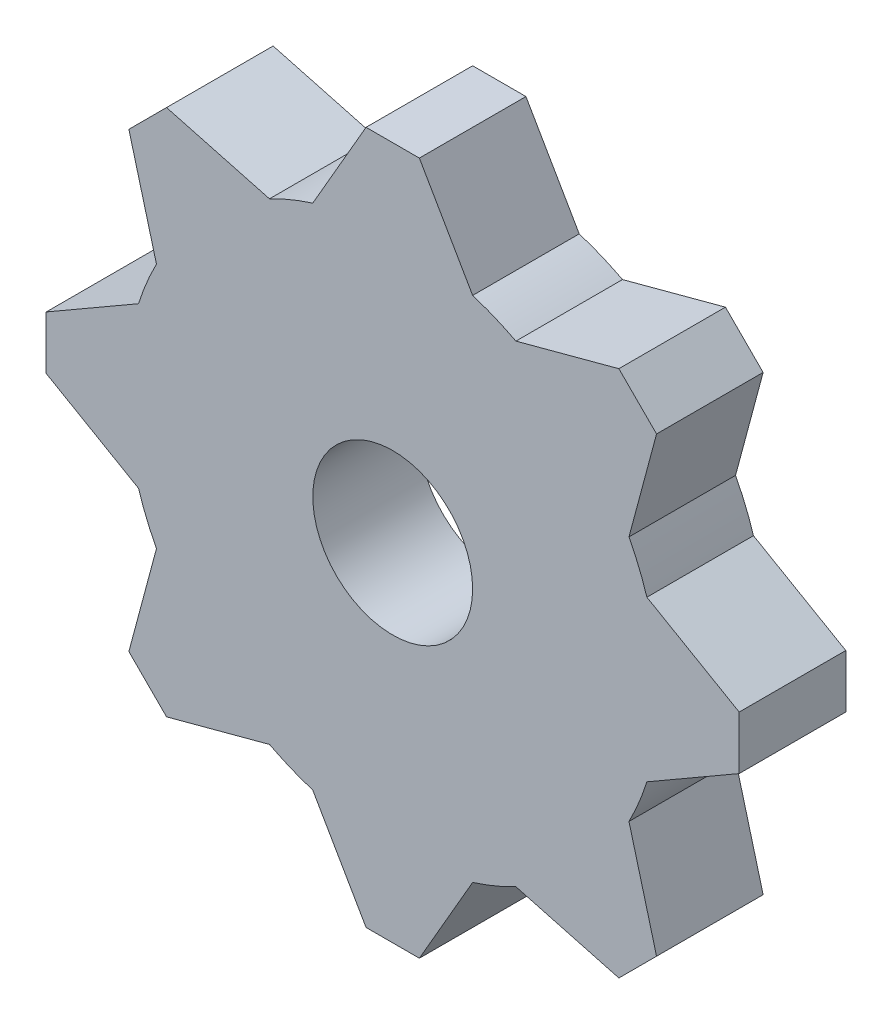
from build123d import *

# Parameters (mm, degrees)
SZKIC1_R                    = 15
DODANIE_WYCI_GNI_CIE1_DEPTH = 20


with BuildPart() as part:
    # Szkic1 → Dodanie-wyciągnięcie1 (new body)
    with BuildSketch(Plane.XY):
        with BuildLine():
            Line((-5, 65.017468147), (5, 65.017468147))
            Line((5, 65.017468147), (15, 47.696960071))
            ThreePointArc((15, 47.696960071), (19.134171618, 46.193976626), (23.12024219, 44.333445626))
            Line((23.12024219, 44.333445626), (42.438758716, 49.509826528))
            Line((42.438758716, 49.509826528), (49.509826528, 42.438758716))
            Line((49.509826528, 42.438758716), (44.333445626, 23.12024219))
            ThreePointArc((44.333445626, 23.12024219), (46.193976626, 19.134171618), (47.696960071, 15))
            Line((47.696960071, 15), (65.017468147, 5))
            Line((65.017468147, 5), (65.017468147, -5))
            Line((65.017468147, -5), (47.696960071, -15))
            ThreePointArc((47.696960071, -15), (46.193976626, -19.134171618), (44.333445626, -23.12024219))
            Line((44.333445626, -23.12024219), (49.509826528, -42.438758716))
            Line((49.509826528, -42.438758716), (42.438758716, -49.509826528))
            Line((42.438758716, -49.509826528), (23.12024219, -44.333445626))
            ThreePointArc((23.12024219, -44.333445626), (19.134171618, -46.193976626), (15, -47.696960071))
            Line((15, -47.696960071), (5, -65.017468147))
            Line((5, -65.017468147), (-5, -65.017468147))
            Line((-5, -65.017468147), (-15, -47.696960071))
            ThreePointArc((-15, -47.696960071), (-19.134171618, -46.193976626), (-23.12024219, -44.333445626))
            Line((-23.12024219, -44.333445626), (-42.438758716, -49.509826528))
            Line((-42.438758716, -49.509826528), (-49.509826528, -42.438758716))
            Line((-49.509826528, -42.438758716), (-44.333445626, -23.12024219))
            ThreePointArc((-44.333445626, -23.12024219), (-46.193976626, -19.134171618), (-47.696960071, -15))
            Line((-47.696960071, -15), (-65.017468147, -5))
            Line((-65.017468147, -5), (-65.017468147, 5))
            Line((-65.017468147, 5), (-47.696960071, 15))
            ThreePointArc((-47.696960071, 15), (-46.193976626, 19.134171618), (-44.333445626, 23.12024219))
            Line((-44.333445626, 23.12024219), (-49.509826528, 42.438758716))
            Line((-49.509826528, 42.438758716), (-42.438758716, 49.509826528))
            Line((-42.438758716, 49.509826528), (-23.12024219, 44.333445626))
            ThreePointArc((-23.12024219, 44.333445626), (-19.134171618, 46.193976626), (-15, 47.696960071))
            Line((-15, 47.696960071), (-5, 65.017468147))
        make_face()
        Circle(SZKIC1_R, mode=Mode.SUBTRACT)
    extrude(amount=DODANIE_WYCI_GNI_CIE1_DEPTH)


solid = part.part
